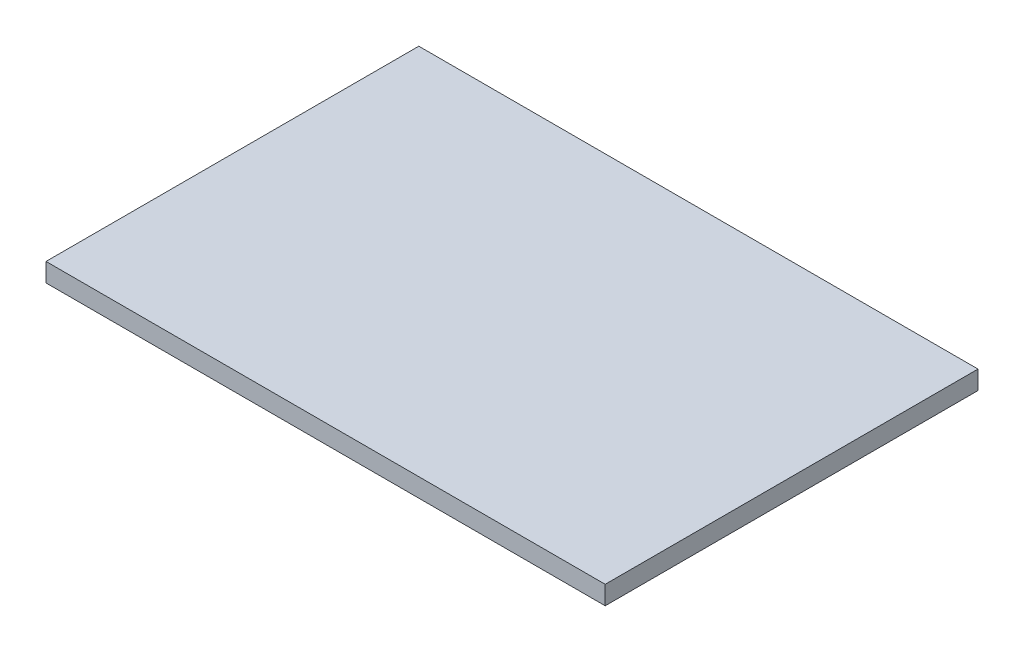
from build123d import *

# Parameters (mm, degrees)
SKETCH1_W           = 90
SKETCH1_H           = 60
BOSS_EXTRUDE1_DEPTH = 3


with BuildPart() as part:
    # Sketch1 → Boss-Extrude1 (new body)
    with BuildSketch(Plane(origin=(0, 0, 0), x_dir=(1, 0, 0), z_dir=(0, 1, 0))):
        with Locations((45, 30)):
            Rectangle(SKETCH1_W, SKETCH1_H)
    extrude(amount=BOSS_EXTRUDE1_DEPTH)


solid = part.part
